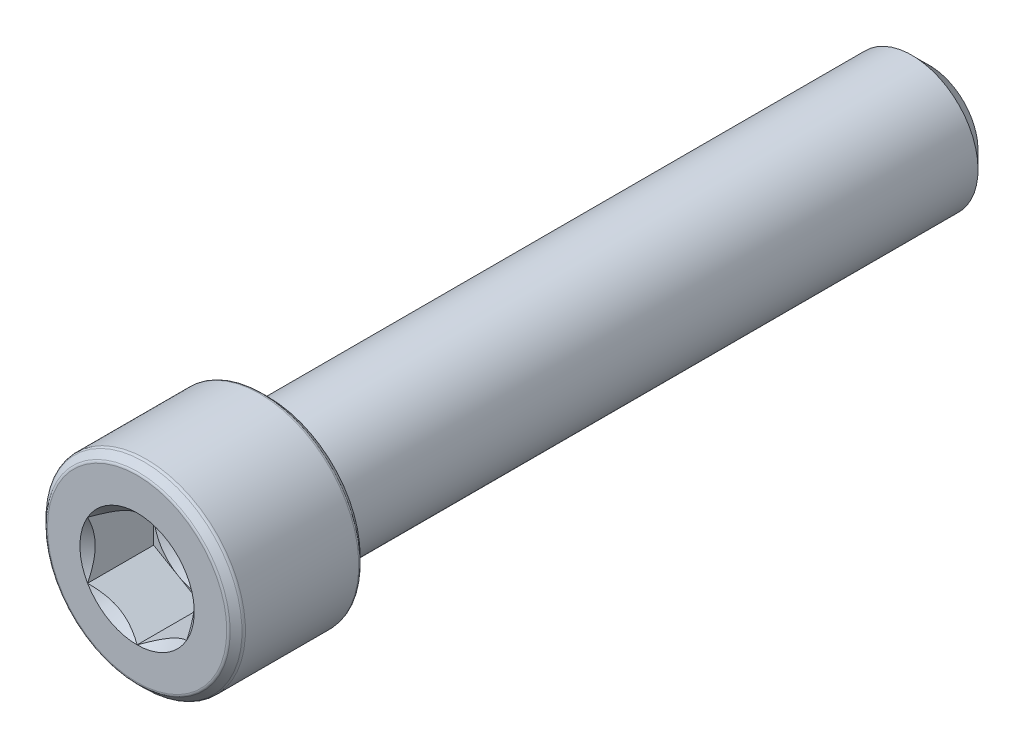
from build123d import *

# Parameters (mm, degrees)
CUT_EXTRUDE1_DEPTH = 3.175


with BuildPart() as part:
    # Sketch3 → Revolve1 (revolve)
    with BuildSketch(Plane(origin=(0, 0, 0), x_dir=(0, 0, -1), z_dir=(1, 0, 0)), mode=Mode.PRIVATE) as revolve1_sk:
        with BuildLine():
            Line((-19.05, 4.312455777), (-19.05, 2.38125))
            Line((-19.05, 2.38125), (-15.875, 2.38125))
            Line((-15.875, 2.38125), (-15.875, 0))
            Line((-15.875, 0), (19.05, 0))
            Line((19.05, 0), (19.05, 2.350110803))
            Line((19.05, 2.350110803), (18.225110803, 3.175))
            Line((18.225110803, 3.175), (-12.7, 3.175))
            Line((-12.7, 3.175), (-12.7, 4.312455777))
            ThreePointArc((-12.7, 4.312455777), (-12.71268833, 4.376244321), (-12.748821638, 4.430321638))
            Line((-12.748821638, 4.430321638), (-13.032178362, 4.713678362))
            ThreePointArc((-13.032178362, 4.713678362), (-13.086255679, 4.74981167), (-13.150044223, 4.7625))
            Line((-13.150044223, 4.7625), (-18.599955777, 4.7625))
            ThreePointArc((-18.599955777, 4.7625), (-18.663744321, 4.74981167), (-18.717821638, 4.713678362))
            Line((-18.717821638, 4.713678362), (-19.001178362, 4.430321638))
            ThreePointArc((-19.001178362, 4.430321638), (-19.03731167, 4.376244321), (-19.05, 4.312455777))
        make_face()
    revolve(revolve1_sk.sketch.rotate(Axis((0, 0, 19.05), (0, 0, -1)), 180), axis=Axis((0, 0, 19.05), (0, 0, -1)))

    # Sketch4 → Cut-Extrude1 (cut)
    with BuildSketch(Plane.XY.offset(19.05)):
        Polygon((0, 2.749630657), (-2.38125, 1.374815329), (-2.38125, -1.374815329), (0, -2.749630657), (2.38125, -1.374815329), (2.38125, 1.374815329), align=None)
    extrude(amount=-CUT_EXTRUDE1_DEPTH, mode=Mode.SUBTRACT)

    # Cut-Extrude2 cone 1 section (through the dimple's axis) → Cut-Extrude2 (revolve, cut)
    with BuildSketch(Plane(origin=(0, 0, 19.05), x_dir=(0, -1, 0), z_dir=(1, 0, 0))):
        Polygon((0, 0), (2.749630657, 0), (0, 2.749630657), align=None)
    revolve(axis=Axis((0, 0, 19.05), (0, 0, -1)), mode=Mode.SUBTRACT)

    # Cut-Extrude3 cone 1 section (through the dimple's axis) → Cut-Extrude3 (revolve, cut)
    with BuildSketch(Plane(origin=(0, 0, 15.875), x_dir=(0, -1, 0), z_dir=(1, 0, 0))):
        Polygon((0, 0), (2.38125, 0), (0, 1.374815329), align=None)
    revolve(axis=Axis((0, 0, 15.875), (0, 0, -1)), mode=Mode.SUBTRACT)


solid = part.part
